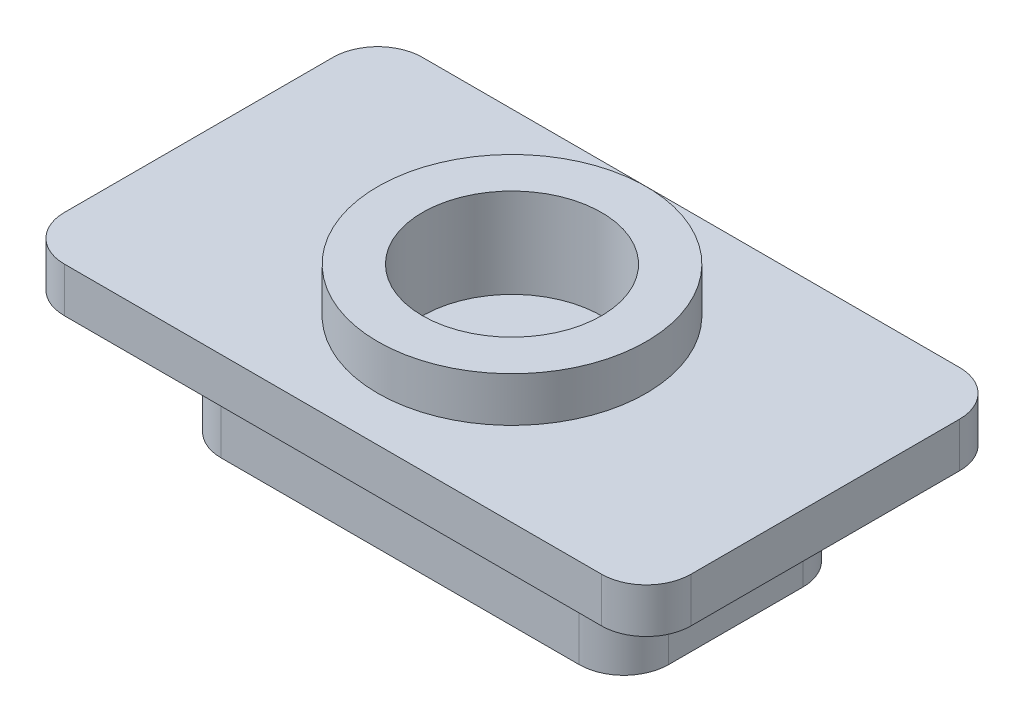
from build123d import *

# Parameters (mm, degrees)
SALIENTE_EXTRUIR1_DEPTH = 2.5
SALIENTE_EXTRUIR2_DEPTH = 1
CROQUIS3_R              = 3
SALIENTE_EXTRUIR3_DEPTH = 1
CROQUIS4_R              = 2
CORTAR_EXTRUIR1_DEPTH   = 2


with BuildPart() as part:
    # Croquis1 → Saliente-Extruir1 (new body)
    with BuildSketch(Plane(origin=(0, 0, 0), x_dir=(1, 0, 0), z_dir=(0, 1, 0))):
        with BuildLine():
            Line((-4, -2.5), (4, -2.5))
            ThreePointArc((4, -2.5), (4.707106781, -2.207106781), (5, -1.5))
            Line((5, -1.5), (5, 1.5))
            ThreePointArc((5, 1.5), (4.707106781, 2.207106781), (4, 2.5))
            Line((4, 2.5), (-4, 2.5))
            ThreePointArc((-4, 2.5), (-4.707106781, 2.207106781), (-5, 1.5))
            Line((-5, 1.5), (-5, -1.5))
            ThreePointArc((-5, -1.5), (-4.707106781, -2.207106781), (-4, -2.5))
        make_face()
    extrude(amount=SALIENTE_EXTRUIR1_DEPTH)

    # Croquis2 → Saliente-Extruir2 (add)
    with BuildSketch(Plane(origin=(0, 2.5, 0), x_dir=(1, 0, 0), z_dir=(0, 1, 0))):
        with BuildLine():
            Line((-6, -4), (6, -4))
            ThreePointArc((6, -4), (6.707106781, -3.707106781), (7, -3))
            Line((7, -3), (7, 3))
            ThreePointArc((7, 3), (6.707106781, 3.707106781), (6, 4))
            Line((6, 4), (-6, 4))
            ThreePointArc((-6, 4), (-6.707106781, 3.707106781), (-7, 3))
            Line((-7, 3), (-7, -3))
            ThreePointArc((-7, -3), (-6.707106781, -3.707106781), (-6, -4))
        make_face()
    extrude(amount=SALIENTE_EXTRUIR2_DEPTH)

    # Croquis3 → Saliente-Extruir3 (add)
    with BuildSketch(Plane(origin=(0, 3.5, 0), x_dir=(1, 0, 0), z_dir=(0, 1, 0))):
        with Locations(Location((0, 0, 0), (0, 0, 270))):
            Circle(CROQUIS3_R)
    extrude(amount=SALIENTE_EXTRUIR3_DEPTH)

    # Croquis4 → Cortar-Extruir1 (cut)
    with BuildSketch(Plane(origin=(0, 4.5, 0), x_dir=(1, 0, 0), z_dir=(0, 1, 0))):
        with Locations(Location((0, 0, 0), (0, 0, 270))):
            Circle(CROQUIS4_R)
    extrude(amount=-CORTAR_EXTRUIR1_DEPTH, mode=Mode.SUBTRACT)


solid = part.part
